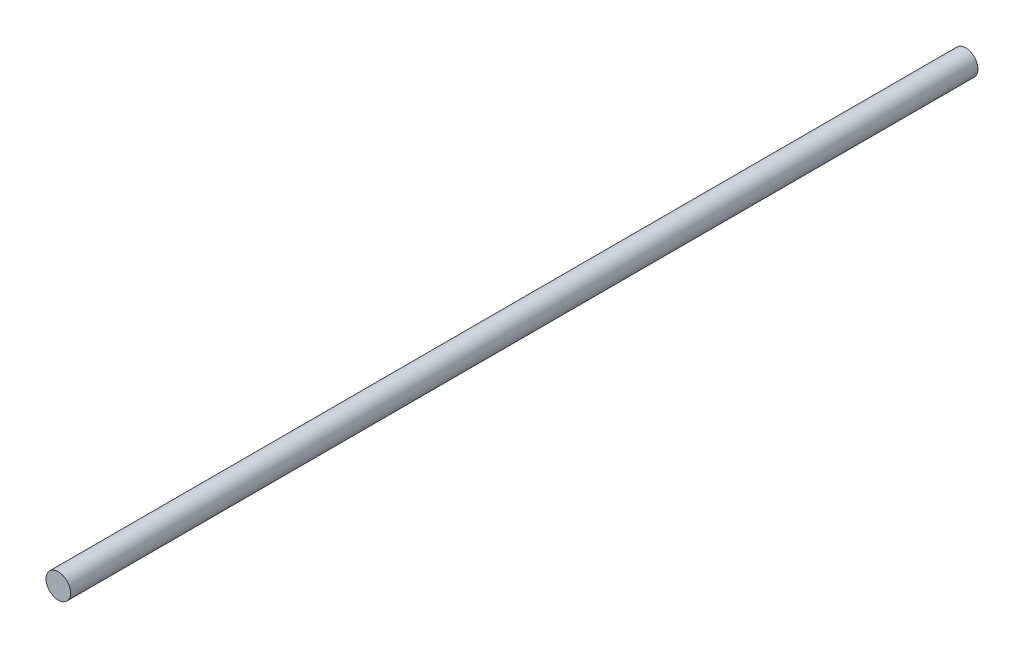
from build123d import *

# Parameters (mm, degrees)
ESQUISSE1_R        = 2.105
BOSS_EXTRU_1_DEPTH = 155


with BuildPart() as part:
    # Esquisse1 → Boss.-Extru.1 (new body)
    with BuildSketch(Plane.XY):
        Circle(ESQUISSE1_R)
    extrude(amount=BOSS_EXTRU_1_DEPTH)


solid = part.part
